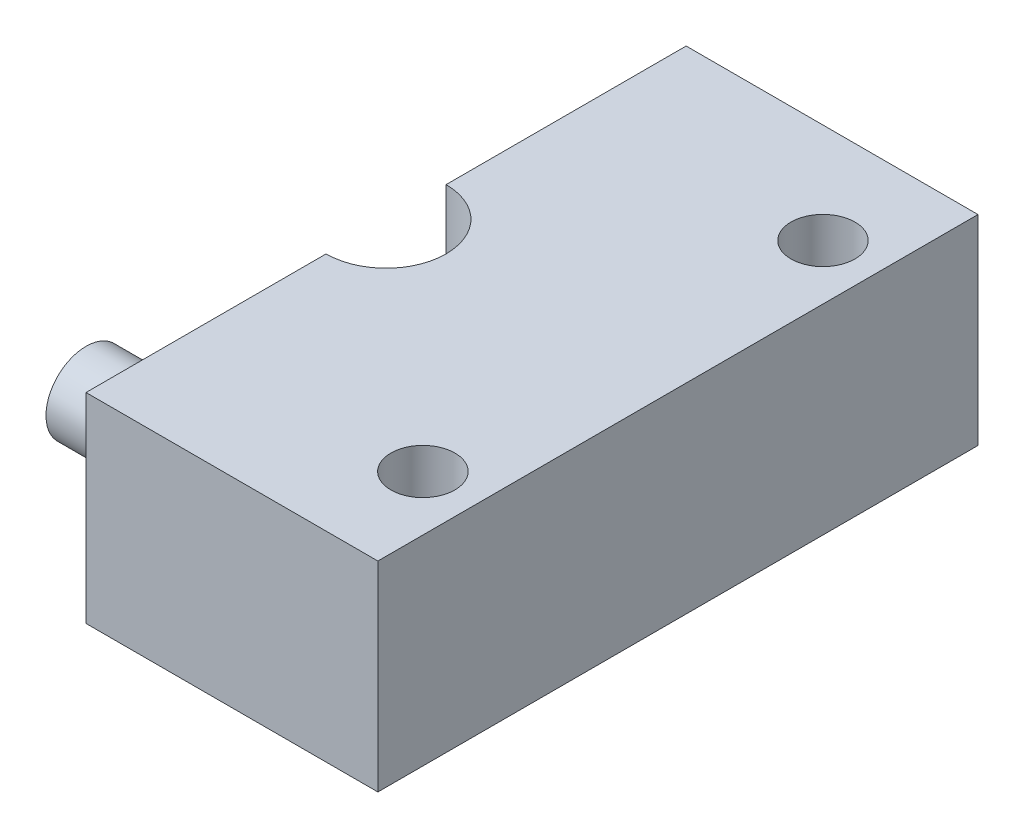
from build123d import *

# Parameters (mm, degrees)
SKETCH1_W           = 14.59
SKETCH1_H           = 10
BOSS_EXTRUDE1_DEPTH = 30
CUT_EXTRUDE1_DEPTH  = 3
SKETCH3_R           = 1.6
CUT_EXTRUDE2_DEPTH  = 10
CUT_EXTRUDE3_DEPTH  = 7
SKETCH5_R           = 2
BOSS_EXTRUDE2_DEPTH = 5
FILLET1_R           = 1
SKETCH6_R           = 2.075
CUT_EXTRUDE4_DEPTH  = 5
FILLET2_R           = 1


with BuildPart() as part:
    # Sketch1 → Boss-Extrude1 (new body)
    with BuildSketch(Plane.XY):
        with Locations((7.295, 5)):
            Rectangle(SKETCH1_W, SKETCH1_H)
    extrude(amount=BOSS_EXTRUDE1_DEPTH)

    # Sketch2 → Cut-Extrude1 (cut)
    with BuildSketch(Plane.XZ):
        with BuildLine():
            Line((0, 21), (3.507491981, 21))
            ThreePointArc((3.507491981, 21), (6.95, 15), (3.507491981, 9))
            Line((3.507491981, 9), (0, 9))
            Line((0, 9), (0, 21))
        make_face()
    extrude(amount=-CUT_EXTRUDE1_DEPTH, mode=Mode.SUBTRACT)

    # Sketch3 → Cut-Extrude2 (cut)
    with BuildSketch(Plane(origin=(0, 10, 0), x_dir=(1, 0, 0), z_dir=(0, 1, 0))):
        with Locations(Location((11.84, -5, 0), (0, 0, 270))):
            Circle(SKETCH3_R)
        with Locations(Location((11.84, -25, 0), (0, 0, 270))):
            Circle(SKETCH3_R)
    extrude(amount=-CUT_EXTRUDE2_DEPTH, mode=Mode.SUBTRACT)

    # Sketch4 → Cut-Extrude3 (cut)
    with BuildSketch(Plane(origin=(0, 10, 0), x_dir=(1, 0, 0), z_dir=(0, 1, 0))):
        with BuildLine():
            Line((0, -12), (0, -18))
            ThreePointArc((0, -18), (3, -15), (0, -12))
        make_face()
    extrude(amount=-CUT_EXTRUDE3_DEPTH, mode=Mode.SUBTRACT)

    # Sketch5 → Boss-Extrude2 (add)
    with BuildSketch(Plane.ZY):
        with Locations(Location((25, 5, 0), (0, 0, 180))):
            Circle(SKETCH5_R)
    extrude(amount=BOSS_EXTRUDE2_DEPTH)

    # Fillet1
    fillet1_edges = [part.edges().sort_by_distance(p)[0] for p in [
        (0, 5, 27),
    ]]
    fillet(fillet1_edges, radius=FILLET1_R)

    # Sketch6 → Cut-Extrude4 (cut)
    with BuildSketch(Plane.ZY):
        with Locations((5, 5)):
            Circle(SKETCH6_R)
    extrude(amount=-CUT_EXTRUDE4_DEPTH, mode=Mode.SUBTRACT)

    # Fillet2
    fillet2_edges = [part.edges().sort_by_distance(p)[0] for p in [
        (0, 5, 2.925),
    ]]
    fillet(fillet2_edges, radius=FILLET2_R)


solid = part.part
